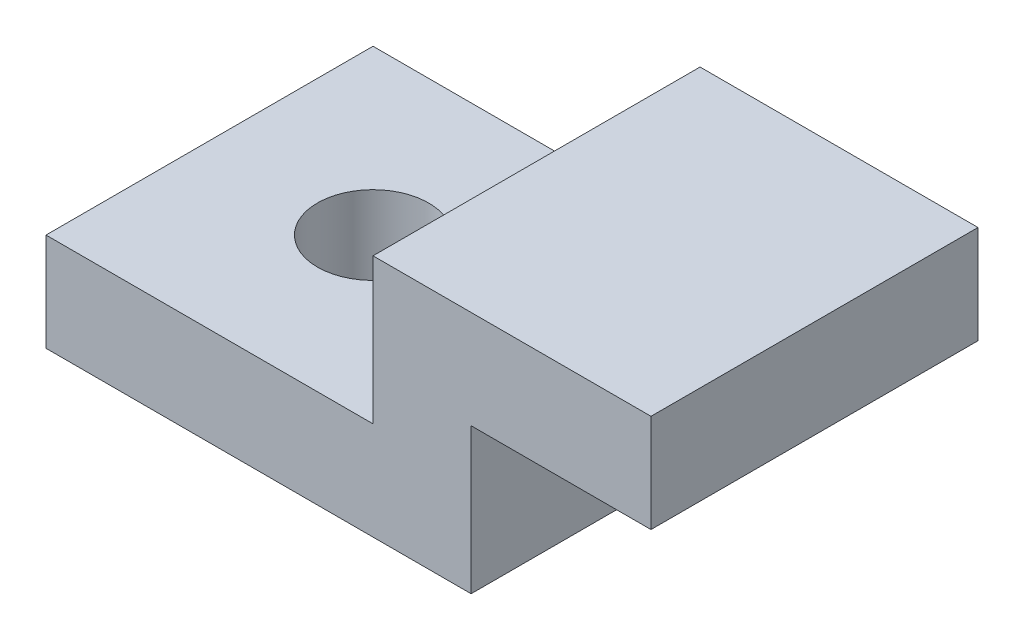
from build123d import *

# Parameters (mm, degrees)
BOSS_EXTRUDE1_DEPTH  = 5
M3_CLEARANCE_HOLE1_D = 3.4


with BuildPart() as part:
    # Sketch1 → Boss-Extrude1 (new, symmetric)
    with BuildSketch(Plane.XY):
        Polygon((0, 0), (0, 4.45), (5.5, 4.45), (5.5, 7.45), (-3, 7.45), (-3, 3), (-13, 3), (-13, 0), (-3, 0), align=None)
    extrude(amount=BOSS_EXTRUDE1_DEPTH, both=True)

    # M3 Clearance Hole1 (through all)
    with Locations(Plane(origin=(0, 3, 0), x_dir=(1, 0, 0), z_dir=(0, 1, 0))):
        with Locations((-8, 0)):
            Hole(M3_CLEARANCE_HOLE1_D / 2)


solid = part.part
